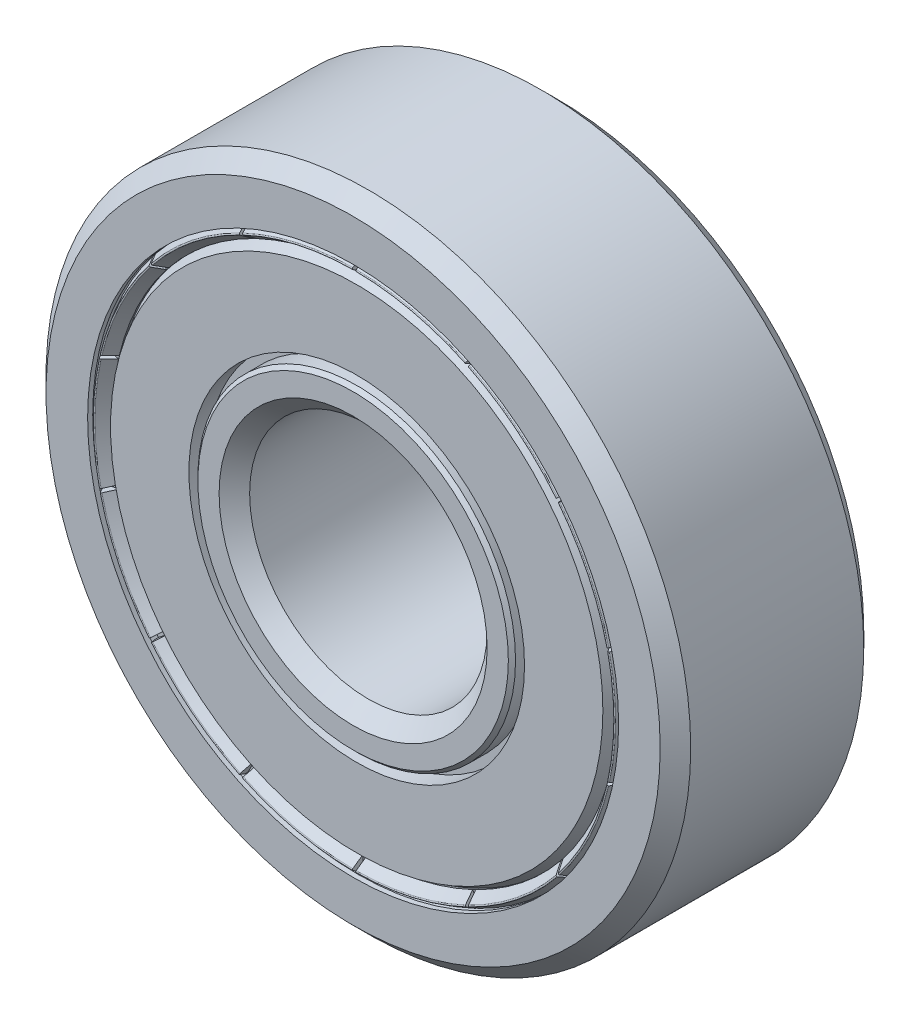
from build123d import *

# Parameters (mm, degrees)
CIRPATTERN1_COUNT  = 7
FILLET1_R          = 0.03
CUT_EXTRUDE1_START = 2.652121
CUT_EXTRUDE1_DEPTH = 12.113778898
CIRPATTERN2_COUNT  = 14


with BuildPart() as part:
    # Sketch3 → Revolve1 (revolve)
    with BuildSketch(Plane(origin=(0, 0, 0), x_dir=(0, 0, -1), z_dir=(1, 0, 0)), mode=Mode.PRIVATE) as revolve1_sk:
        with BuildLine():
            Line((2.55, 9.5), (-2.55, 9.5))
            Line((-2.55, 9.5), (-3, 9.05))
            Line((-3, 9.05), (-3, 7.825174662))
            Line((-3, 7.825174662), (-2.85, 7.825174662))
            Line((-2.85, 7.825174662), (-2.85, 8.212587331))
            Line((-2.85, 8.212587331), (-2.743933983, 8.318653348))
            Line((-2.743933983, 8.318653348), (-1.05, 8.318653348))
            ThreePointArc((-1.05, 8.318653348), (0, 8.6), (1.05, 8.318653348))
            Line((1.05, 8.318653348), (2.743933983, 8.318653348))
            Line((2.743933983, 8.318653348), (2.85, 8.212587331))
            Line((2.85, 8.212587331), (2.85, 7.825174662))
            Line((2.85, 7.825174662), (3, 7.825174662))
            Line((3, 7.825174662), (3, 9.05))
            Line((3, 9.05), (2.55, 9.5))
        make_face()
        with BuildLine():
            Line((2.55, 3.5), (-2.55, 3.5))
            Line((-2.55, 3.5), (-3, 3.95))
            Line((-3, 3.95), (-3, 4.575280635))
            Line((-3, 4.575280635), (-2.893933983, 4.681346652))
            Line((-2.893933983, 4.681346652), (-1.05, 4.681346652))
            ThreePointArc((-1.05, 4.681346652), (0, 4.4), (1.05, 4.681346652))
            Line((1.05, 4.681346652), (2.893933983, 4.681346652))
            Line((2.893933983, 4.681346652), (3, 4.575280635))
            Line((3, 4.575280635), (3, 3.95))
            Line((3, 3.95), (2.55, 3.5))
        make_face()
    revolve(revolve1_sk.sketch.rotate(Axis((0, 0, 3), (0, 0, -1)), 90), axis=Axis((0, 0, 3), (0, 0, -1)))


with BuildPart() as body_2:
    # Sketch4 → Revolve2 (revolve)
    with BuildSketch(Plane(origin=(0, 0, 0), x_dir=(0, 0, -1), z_dir=(1, 0, 0))):
        with BuildLine():
            Line((0, 8.6), (0, 4.4))
            ThreePointArc((0, 4.4), (-2.1, 6.5), (0, 8.6))
        make_face()
    revolve(axis=Axis((0, 9.5, 0), (0, -1, 0)))


with BuildPart() as cirpattern1_1:
    # CirPattern1: pattern copy
    add(body_2.part.rotate(Axis((0, 0, 0), (0, 0, 1)), 1 * 360 / CIRPATTERN1_COUNT))


with BuildPart() as cirpattern1_2:
    # CirPattern1: pattern copy
    add(body_2.part.rotate(Axis((0, 0, 0), (0, 0, 1)), 2 * 360 / CIRPATTERN1_COUNT))


with BuildPart() as cirpattern1_3:
    # CirPattern1: pattern copy
    add(body_2.part.rotate(Axis((0, 0, 0), (0, 0, 1)), 3 * 360 / CIRPATTERN1_COUNT))


with BuildPart() as cirpattern1_4:
    # CirPattern1: pattern copy
    add(body_2.part.rotate(Axis((0, 0, 0), (0, 0, 1)), 4 * 360 / CIRPATTERN1_COUNT))


with BuildPart() as cirpattern1_5:
    # CirPattern1: pattern copy
    add(body_2.part.rotate(Axis((0, 0, 0), (0, 0, 1)), 5 * 360 / CIRPATTERN1_COUNT))


with BuildPart() as cirpattern1_6:
    # CirPattern1: pattern copy
    add(body_2.part.rotate(Axis((0, 0, 0), (0, 0, 1)), 6 * 360 / CIRPATTERN1_COUNT))


with BuildPart() as body_9:
    # Sketch5 → Revolve3 (revolve)
    with BuildSketch(Plane(origin=(0, 0, 0), x_dir=(0, 0, -1), z_dir=(1, 0, 0)), mode=Mode.PRIVATE) as revolve3_sk:
        Polygon((-2.1, 4.681346652), (-2.364644661, 4.681346652), (-2.364644661, 4.945991313), (-2.893933983, 4.945991313), (-2.893933983, 7.254944668), (-2.364644661, 7.560530001), (-2.1, 7.560530001), align=None)
        Polygon((2.364644661, 7.560530001), (2.1, 7.560530001), (2.1, 4.681346652), (2.364644661, 4.681346652), (2.364644661, 4.945991313), (2.893933983, 4.945991313), (2.893933983, 7.254944668), align=None)
    revolve(revolve3_sk.sketch.rotate(Axis((0, 0, 3), (0, 0, -1)), 90), axis=Axis((0, 0, 3), (0, 0, -1)))


with BuildPart() as body_10:
    # Sketch6 → Revolve4 (revolve)
    with BuildSketch(Plane(origin=(0, 0, 0), x_dir=(0, 0, -1), z_dir=(1, 0, 0)), mode=Mode.PRIVATE) as revolve4_sk:
        Polygon((-2.566742823, 7.825174662), (-2.7375, 7.825174662), (-3, 7.673620216), (-2.656742823, 7.433268953), (-2.626742823, 7.433268953), (-2.566742823, 7.443848572), align=None)
    revolve(revolve4_sk.sketch.rotate(Axis((0, 0, 3), (0, 0, -1)), 90), axis=Axis((0, 0, 3), (0, 0, -1)))

    # Fillet1
    fillet1_edges = [body_10.edges().sort_by_distance(p)[0] for p in [
        (-7.673620216, 0, 3),
    ]]
    fillet(fillet1_edges, radius=FILLET1_R)

    # Sketch7 → Cut-Extrude1 (cut, through all)
    with BuildSketch(Plane.XY.offset(CUT_EXTRUDE1_START)):
        Polygon((-0.05, 7.825174662), (-0.05, 7.925174662), (0.05, 7.925174662), (0.05, 7.825174662), (0.05, 7.433268953), (0.05, 7.333268953), (-0.05, 7.333268953), (-0.05, 7.433268953), align=None)
    cut_extrude1 = extrude(amount=CUT_EXTRUDE1_DEPTH, mode=Mode.SUBTRACT)

    # CirPattern2: Cut-Extrude1 ×14 about axis
    cirpattern2_axis = Axis((0, 0, 3), (0, 0, -1))
    for i in range(1, CIRPATTERN2_COUNT):
        add(cut_extrude1.rotate(cirpattern2_axis, i * 360 / CIRPATTERN2_COUNT), mode=Mode.SUBTRACT)


with BuildPart() as body_11:
    # Mirror1: mirrored copy
    add(body_10.part.mirror(Plane.XY))


solid = Compound([part.part, body_2.part, cirpattern1_1.part, cirpattern1_2.part, cirpattern1_3.part, cirpattern1_4.part, cirpattern1_5.part, cirpattern1_6.part, body_9.part, body_10.part, body_11.part])
